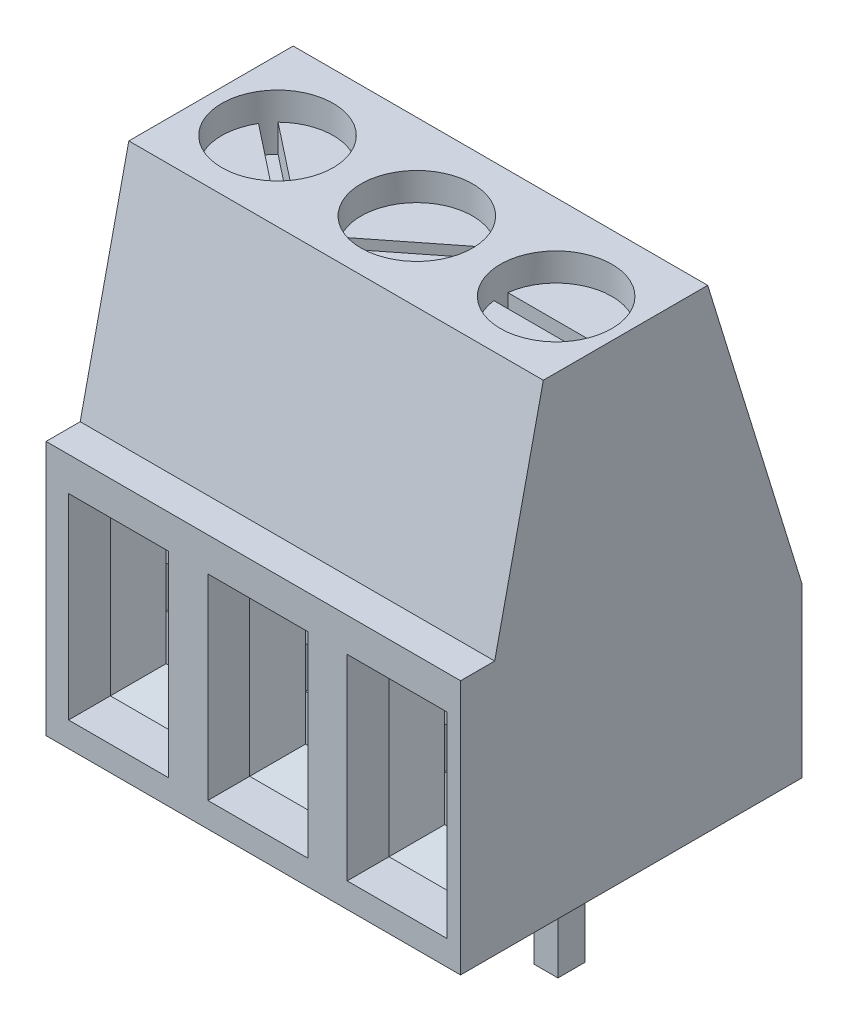
from build123d import *

# Parameters (mm, degrees)
SKETCH1_W          = 20.701
SKETCH1_H          = 6.223
EXTRUDE1_DEPTH     = 8.636
CUT_EXTRUDE1_DEPTH = 25.4
CUT_EXTRUDE2_DEPTH = 25.4
SKETCH4_R          = 1.016
CUT_EXTRUDE3_DEPTH = 0.508
CUT_EXTRUDE4_DEPTH = 0.508
SKETCH6_W          = 1.82195604
SKETCH6_H          = 3.576432228
CUT_EXTRUDE5_DEPTH = 1.27
CHAMFER1_SIZE      = 0.508
SKETCH7_W          = 0.80595604
SKETCH7_H          = 0.757943843
CUT_EXTRUDE6_DEPTH = 1.27
SKETCH8_W          = 0.433382436
SKETCH8_H          = 0.491166761
EXTRUDE2_DEPTH     = 1.905
SKETCH9_W          = 13.835725518
SKETCH9_H          = 11.068580414
CUT_EXTRUDE7_DEPTH = 25.4


with BuildPart() as part:
    # Sketch1 → Extrude1 (new body)
    with BuildSketch(Plane(origin=(0, 0, 0), x_dir=(1, 0, 0), z_dir=(0, 1, 0))):
        with Locations((10.3505, 3.1115)):
            Rectangle(SKETCH1_W, SKETCH1_H)
    extrude(amount=EXTRUDE1_DEPTH)

    # Sketch2 → Cut-Extrude1 (cut)
    with BuildSketch(Plane(origin=(20.701, 0, 0), x_dir=(0, 0, -1), z_dir=(1, 0, 0))):
        Polygon((-2.869110069, 4.645946632), (0.62179162, 4.645946632), (2.217632392, 11.827230107), (-2.869110069, 11.827230107), align=None)
    extrude(amount=-CUT_EXTRUDE1_DEPTH, mode=Mode.SUBTRACT)

    # Sketch3 → Cut-Extrude2 (cut)
    with BuildSketch(Plane(origin=(20.701, 0, 0), x_dir=(0, 0, -1), z_dir=(1, 0, 0))):
        Polygon((4.012953261, 10.231389335), (6.905414661, 0.855824797), (9.199435771, 0.855824797), (9.199435771, 10.231389335), align=None)
    extrude(amount=-CUT_EXTRUDE2_DEPTH, mode=Mode.SUBTRACT)

    # Sketch4 → Cut-Extrude3 (cut)
    with BuildSketch(Plane(origin=(0, 8.636, 0), x_dir=(1, 0, 0), z_dir=(0, 1, 0))):
        with Locations(Location((1.27, 2.949100672, 0), (0, 0, 270))):
            Circle(SKETCH4_R)
        with Locations(Location((3.81, 2.949100672, 0), (0, 0, 270))):
            Circle(SKETCH4_R)
        with Locations(Location((6.35, 2.949100672, 0), (0, 0, 270))):
            Circle(SKETCH4_R)
        with Locations(Location((8.89, 2.949100672, 0), (0, 0, 270))):
            Circle(SKETCH4_R)
        with Locations(Location((11.43, 2.949100672, 0), (0, 0, 270))):
            Circle(SKETCH4_R)
        with Locations(Location((13.97, 2.949100672, 0), (0, 0, 270))):
            Circle(SKETCH4_R)
        with Locations(Location((16.51, 2.949100672, 0), (0, 0, 270))):
            Circle(SKETCH4_R)
        with Locations(Location((19.05, 2.949100672, 0), (0, 0, 270))):
            Circle(SKETCH4_R)
    extrude(amount=-CUT_EXTRUDE3_DEPTH, mode=Mode.SUBTRACT)

    # Sketch5 → Cut-Extrude4 (cut)
    with BuildSketch(Plane(origin=(0, 8.128, 0), x_dir=(1, 0, 0), z_dir=(0, 1, 0))):
        with BuildLine():
            ThreePointArc((0.55685802, 3.67276117), (0.471993814, 3.577942566), (0.399647546, 3.473259623))
            Line((0.399647546, 3.473259623), (1.98314198, 2.225440174))
            ThreePointArc((1.98314198, 2.225440174), (2.068006186, 2.320258778), (2.140352454, 2.42494172))
            Line((2.140352454, 2.42494172), (0.55685802, 3.67276117))
        make_face()
        with BuildLine():
            ThreePointArc((2.939647546, 2.42494172), (3.011993814, 2.320258778), (3.09685802, 2.225440174))
            Line((3.09685802, 2.225440174), (4.680352454, 3.473259623))
            ThreePointArc((4.680352454, 3.473259623), (4.608006186, 3.577942566), (4.52314198, 3.67276117))
            Line((4.52314198, 3.67276117), (2.939647546, 2.42494172))
        make_face()
        with BuildLine():
            ThreePointArc((5.34196875, 3.076100672), (5.334, 2.949100672), (5.34196875, 2.822100672))
            Line((5.34196875, 2.822100672), (7.35803125, 2.822100672))
            ThreePointArc((7.35803125, 2.822100672), (7.364005855, 2.885475793), (7.366, 2.949100672))
            ThreePointArc((7.366, 2.949100672), (7.364005855, 3.012725551), (7.35803125, 3.076100672))
            Line((7.35803125, 3.076100672), (5.34196875, 3.076100672))
        make_face()
        with BuildLine():
            ThreePointArc((8.458529789, 2.041483422), (8.576688012, 1.994233554), (8.699870069, 1.9622946))
            Line((8.699870069, 1.9622946), (9.321470211, 3.856717921))
            ThreePointArc((9.321470211, 3.856717921), (9.203311988, 3.90396779), (9.080129931, 3.935906744))
            Line((9.080129931, 3.935906744), (8.458529789, 2.041483422))
        make_face()
        with BuildLine():
            ThreePointArc((11.557, 3.957131921), (11.43, 3.965100672), (11.303, 3.957131921))
            Line((11.303, 3.957131921), (11.303, 1.941069422))
            ThreePointArc((11.303, 1.941069422), (11.43, 1.933100672), (11.557, 1.941069422))
            Line((11.557, 1.941069422), (11.557, 3.957131921))
        make_face()
        with BuildLine():
            ThreePointArc((13.060727808, 3.402399778), (13.011197076, 3.285185412), (12.976706622, 3.162699047))
            Line((12.976706622, 3.162699047), (14.879272192, 2.495801565))
            ThreePointArc((14.879272192, 2.495801565), (14.928802924, 2.613015931), (14.963293378, 2.735502296))
            Line((14.963293378, 2.735502296), (13.060727808, 3.402399778))
        make_face()
        with BuildLine():
            ThreePointArc((16.944941036, 3.867295801), (16.826755289, 3.914461789), (16.703600756, 3.946484624))
            Line((16.703600756, 3.946484624), (16.075058964, 2.030905542))
            ThreePointArc((16.075058964, 2.030905542), (16.193244711, 1.983739555), (16.316399244, 1.95171672))
            Line((16.316399244, 1.95171672), (16.944941036, 3.867295801))
        make_face()
        with BuildLine():
            ThreePointArc((18.349819557, 3.662547267), (18.264852019, 3.567810091), (18.192609083, 3.463045721))
            Line((18.192609083, 3.463045721), (19.750180443, 2.235654077))
            ThreePointArc((19.750180443, 2.235654077), (19.835147981, 2.330391253), (19.907390917, 2.435155623))
            Line((19.907390917, 2.435155623), (18.349819557, 3.662547267))
        make_face()
    extrude(amount=-CUT_EXTRUDE4_DEPTH, mode=Mode.SUBTRACT)

    # Sketch6 → Cut-Extrude5 (cut)
    with BuildSketch(Plane.XY):
        with Locations((3.861070401, 2.24061075)):
            Rectangle(SKETCH6_W, SKETCH6_H)
        with Locations((1.321070401, 2.24061075)):
            Rectangle(SKETCH6_W, SKETCH6_H)
        with Locations((6.401070401, 2.24061075)):
            Rectangle(SKETCH6_W, SKETCH6_H)
        with Locations((8.941070401, 2.24061075)):
            Rectangle(SKETCH6_W, SKETCH6_H)
        with Locations((11.481070401, 2.24061075)):
            Rectangle(SKETCH6_W, SKETCH6_H)
        with Locations((14.021070401, 2.24061075)):
            Rectangle(SKETCH6_W, SKETCH6_H)
        with Locations((16.561070401, 2.24061075)):
            Rectangle(SKETCH6_W, SKETCH6_H)
        with Locations((19.101070401, 2.24061075)):
            Rectangle(SKETCH6_W, SKETCH6_H)
    extrude(amount=-CUT_EXTRUDE5_DEPTH, mode=Mode.SUBTRACT)

    # Chamfer1
    chamfer1_edges = [part.edges().sort_by_distance(p)[0] for p in [
        (0.410092381, 2.24061075, -1.27),
        (1.321070401, 4.028826864, -1.27),
        (2.232048421, 2.24061075, -1.27),
        (1.321070401, 0.452394636, -1.27),
        (3.861070401, 4.028826864, -1.27),
        (4.772048421, 2.24061075, -1.27),
        (3.861070401, 0.452394636, -1.27),
        (2.950092381, 2.24061075, -1.27),
        (6.401070401, 4.028826864, -1.27),
        (7.312048421, 2.24061075, -1.27),
        (6.401070401, 0.452394636, -1.27),
        (5.490092381, 2.24061075, -1.27),
        (8.941070401, 4.028826864, -1.27),
        (9.852048421, 2.24061075, -1.27),
        (8.941070401, 0.452394636, -1.27),
        (8.030092381, 2.24061075, -1.27),
        (11.481070401, 4.028826864, -1.27),
        (12.392048421, 2.24061075, -1.27),
        (11.481070401, 0.452394636, -1.27),
        (10.570092381, 2.24061075, -1.27),
        (14.021070401, 4.028826864, -1.27),
        (14.932048421, 2.24061075, -1.27),
        (14.021070401, 0.452394636, -1.27),
        (13.110092381, 2.24061075, -1.27),
        (16.561070401, 4.028826864, -1.27),
        (17.472048421, 2.24061075, -1.27),
        (16.561070401, 0.452394636, -1.27),
        (15.650092381, 2.24061075, -1.27),
        (19.101070401, 4.028826864, -1.27),
        (20.012048421, 2.24061075, -1.27),
        (19.101070401, 0.452394636, -1.27),
        (18.190092381, 2.24061075, -1.27),
    ]]
    chamfer(chamfer1_edges, length=CHAMFER1_SIZE)

    # Sketch7 → Cut-Extrude6 (cut)
    with BuildSketch(Plane.XY.offset(-1.27)):
        with Locations((1.321070401, 2.17271271)):
            Rectangle(SKETCH7_W, SKETCH7_H)
        with Locations((3.861070401, 2.17271271)):
            Rectangle(SKETCH7_W, SKETCH7_H)
        with Locations((6.401070401, 2.17271271)):
            Rectangle(SKETCH7_W, SKETCH7_H)
        with Locations((8.941070401, 2.17271271)):
            Rectangle(SKETCH7_W, SKETCH7_H)
        with Locations((11.481070401, 2.17271271)):
            Rectangle(SKETCH7_W, SKETCH7_H)
        with Locations((14.021070401, 2.17271271)):
            Rectangle(SKETCH7_W, SKETCH7_H)
        with Locations((16.561070401, 2.17271271)):
            Rectangle(SKETCH7_W, SKETCH7_H)
        with Locations((19.101070401, 2.17271271)):
            Rectangle(SKETCH7_W, SKETCH7_H)
    extrude(amount=-CUT_EXTRUDE6_DEPTH, mode=Mode.SUBTRACT)

    # Sketch8 → Extrude2 (add)
    with BuildSketch(Plane.XZ):
        with Locations((3.829530977, -2.990246105)):
            Rectangle(SKETCH8_W, SKETCH8_H)
        with Locations((1.289530977, -2.990246105)):
            Rectangle(SKETCH8_W, SKETCH8_H)
        with Locations((6.369530977, -2.990246105)):
            Rectangle(SKETCH8_W, SKETCH8_H)
        with Locations((8.909530977, -2.990246105)):
            Rectangle(SKETCH8_W, SKETCH8_H)
        with Locations((11.449530977, -2.990246105)):
            Rectangle(SKETCH8_W, SKETCH8_H)
        with Locations((13.989530977, -2.990246105)):
            Rectangle(SKETCH8_W, SKETCH8_H)
        with Locations((16.529530977, -2.990246105)):
            Rectangle(SKETCH8_W, SKETCH8_H)
        with Locations((19.069530977, -2.990246105)):
            Rectangle(SKETCH8_W, SKETCH8_H)
    extrude(amount=EXTRUDE2_DEPTH)

    # Sketch9 → Cut-Extrude7 (cut)
    with BuildSketch(Plane(origin=(0, 8.636, 0), x_dir=(1, 0, 0), z_dir=(0, 1, 0))):
        with Locations((14.474610491, 2.472928053)):
            Rectangle(SKETCH9_W, SKETCH9_H)
    extrude(amount=-CUT_EXTRUDE7_DEPTH, mode=Mode.SUBTRACT)


solid = part.part
